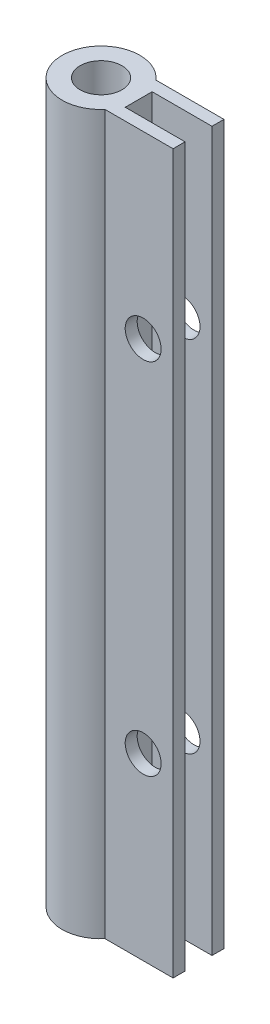
from build123d import *

# Parameters (mm, degrees)
SKETCH1_R           = 1.75
BOSS_EXTRUDE1_DEPTH = 60
SKETCH2_R           = 1.5
CUT_EXTRUDE1_DEPTH  = 60


with BuildPart() as part:
    # Sketch1 → Boss-Extrude1 (new body)
    with BuildSketch(Plane(origin=(0, 0, 0), x_dir=(1, 0, 0), z_dir=(0, 1, 0))):
        with BuildLine():
            Line((8.14420001, -1.125), (8.14420001, -2.125))
            Line((8.14420001, -2.125), (2.459039447, -2.125))
            ThreePointArc((2.459039447, -2.125), (-3.25, 0), (2.459039447, 2.125))
            Line((2.459039447, 2.125), (8.14420001, 2.125))
            Line((8.14420001, 2.125), (8.14420001, 1.125))
            Line((8.14420001, 1.125), (3.14420001, 1.125))
            Line((3.14420001, 1.125), (3.14420001, -1.125))
            Line((3.14420001, -1.125), (8.14420001, -1.125))
        make_face()
        with Locations(Location((0, 0, 0), (0, 0, 270))):
            Circle(SKETCH1_R, mode=Mode.SUBTRACT)
    extrude(amount=BOSS_EXTRUDE1_DEPTH)

    # Sketch2 → Cut-Extrude1 (cut)
    with BuildSketch(Plane.XY.offset(2.125)):
        with Locations((5.64420001, 45)):
            Circle(SKETCH2_R)
        with Locations((5.64420001, 15)):
            Circle(SKETCH2_R)
    extrude(amount=-CUT_EXTRUDE1_DEPTH, mode=Mode.SUBTRACT)


solid = part.part
